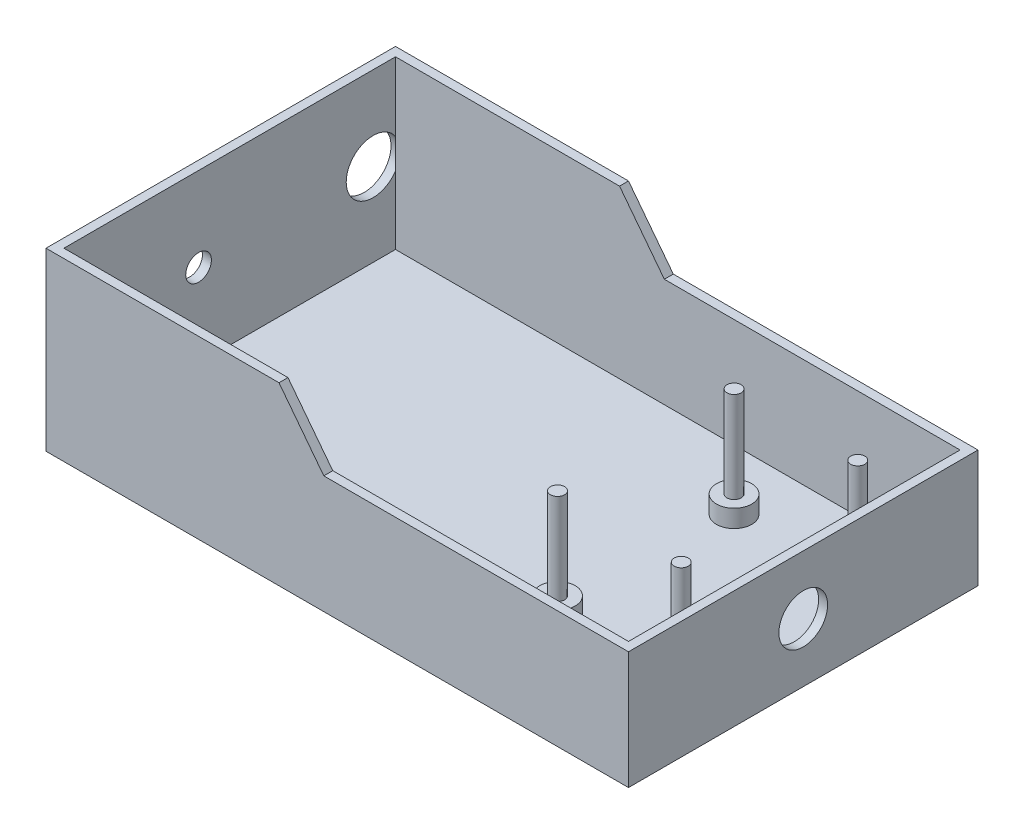
from build123d import *

# Parameters (mm, degrees)
BOSS_EXTRUDE1_DEPTH  = 2.54
SKETCH2_W            = 152.4
SKETCH2_H            = 93.98
BOSS_EXTRUDE2_DEPTH  = 2.54
BOSS_EXTRUDE3_DEPTH  = 2.54
SKETCH4_W            = 152.4
SKETCH4_H            = 2.54
BOSS_EXTRUDE4_DEPTH  = 2.54
BOSS_EXTRUDE13_DEPTH = 2.54
BOSS_EXTRUDE14_DEPTH = 2.54
SKETCH19_W           = 7.62
SKETCH19_H           = 33.3375
BOSS_EXTRUDE15_DEPTH = 2.54
SKETCH20_W           = 7.62
SKETCH20_H           = 33.3375
BOSS_EXTRUDE16_DEPTH = 2.54
SKETCH21_W           = 93.98
SKETCH21_H           = 2.54
BOSS_EXTRUDE17_DEPTH = 7.62
SKETCH22_W           = 2.54
SKETCH22_H           = 33.3375
BOSS_EXTRUDE18_DEPTH = 99.06
SKETCH23_W           = 99.06
SKETCH23_H           = 49.8475
BOSS_EXTRUDE19_DEPTH = 2.54
SKETCH24_R           = 3.639281935
SKETCH24_R_2         = 7.62
SKETCH24_R_3         = 3.285560526
CUT_EXTRUDE2_DEPTH   = 2.54
SKETCH25_R           = 6.906854853
CUT_EXTRUDE3_DEPTH   = 2.54
SKETCH29_R           = 2
BOSS_EXTRUDE20_DEPTH = 30.7975
SKETCH31_R           = 5
BOSS_EXTRUDE21_DEPTH = 5


with BuildPart() as part:
    # Sketch1 → Boss-Extrude1 (new body)
    with BuildSketch(Plane.XY):
        Polygon((0, 0), (152.4, 0), (152.4, 26.9875), (76.2, 26.9875), (63.5, 43.4975), (0, 43.4975), align=None)
    extrude(amount=BOSS_EXTRUDE1_DEPTH)



with BuildPart() as body_2:
    # Sketch2 → Boss-Extrude2 (new body)
    with BuildSketch(Plane(origin=(0, 0, 0), x_dir=(-1, 0, 0), z_dir=(0, -1, 0))):
        with Locations((-76.2, -49.53)):
            Rectangle(SKETCH2_W, SKETCH2_H)
    extrude(amount=BOSS_EXTRUDE2_DEPTH)

    # Sketch3 → Boss-Extrude3 (add)
    with BuildSketch(Plane.XY.offset(96.52)):
        Polygon((0, 0), (0, 43.4975), (63.5, 43.4975), (76.2, 26.9875), (152.4, 26.9875), (152.4, -2.54), (0, -2.54), align=None)
    extrude(amount=BOSS_EXTRUDE3_DEPTH)


with BuildPart() as part_1:
    add(part.part)

    add(body_2.part)  # Boss-Extrude4 merges body 2
    # Sketch4 → Boss-Extrude4 (add)
    with BuildSketch(Plane(origin=(0, 0, 2.54), x_dir=(-1, 0, 0), z_dir=(0, 0, -1))):
        with Locations((-76.2, -1.27)):
            Rectangle(SKETCH4_W, SKETCH4_H)
    extrude(amount=BOSS_EXTRUDE4_DEPTH)

    # Sketch10 → Boss-Extrude13 (add)
    with BuildSketch(Plane(origin=(0, 0, 0), x_dir=(-1, 0, 0), z_dir=(0, 0, -1))):
        Polygon((0, 43.4975), (0, 47.3075), (-63.5, 47.3075), (-76.2, 30.7975), (-152.4, 30.7975), (-152.4, 26.9875), (-76.2, 26.9875), (-63.5, 43.4975), align=None)
    extrude(amount=-BOSS_EXTRUDE13_DEPTH)

    # Sketch18 → Boss-Extrude14 (add)
    with BuildSketch(Plane.XY.offset(99.06)):
        Polygon((0, 43.4975), (0, 47.3075), (63.5, 47.3075), (76.2, 30.7975), (152.4, 30.7975), (152.4, 26.9875), (76.2, 26.9875), (63.5, 43.4975), align=None)
    extrude(amount=-BOSS_EXTRUDE14_DEPTH)

    # Sketch19 → Boss-Extrude15 (add)
    with BuildSketch(Plane.XY.offset(99.06)):
        with Locations((156.21, 14.12875)):
            Rectangle(SKETCH19_W, SKETCH19_H)
    extrude(amount=-BOSS_EXTRUDE15_DEPTH)

    # Sketch20 → Boss-Extrude16 (add)
    with BuildSketch(Plane(origin=(0, 0, 0), x_dir=(-1, 0, 0), z_dir=(0, 0, -1))):
        with Locations((-156.21, 14.12875)):
            Rectangle(SKETCH20_W, SKETCH20_H)
    extrude(amount=-BOSS_EXTRUDE16_DEPTH)

    # Sketch21 → Boss-Extrude17 (add)
    with BuildSketch(Plane(origin=(152.4, 0, 0), x_dir=(0, 0, -1), z_dir=(1, 0, 0))):
        with Locations((-49.53, -1.27)):
            Rectangle(SKETCH21_W, SKETCH21_H)
    extrude(amount=BOSS_EXTRUDE17_DEPTH)

    # Sketch22 → Boss-Extrude18 (add)
    with BuildSketch(Plane.XY.offset(99.06)):
        with Locations((161.29, 14.12875)):
            Rectangle(SKETCH22_W, SKETCH22_H)
    extrude(amount=-BOSS_EXTRUDE18_DEPTH)

    # Sketch23 → Boss-Extrude19 (add)
    with BuildSketch(Plane.ZY):
        with Locations((49.53, 22.38375)):
            Rectangle(SKETCH23_W, SKETCH23_H)
    extrude(amount=BOSS_EXTRUDE19_DEPTH)

    # Sketch24 → Cut-Extrude2 (cut)
    with BuildSketch(Plane.ZY.offset(2.54)):
        with Locations((58.358660758, 23.518484008)):
            Circle(SKETCH24_R)
        with Locations((8.89, 23.518484008)):
            Circle(SKETCH24_R_2)
        with Locations((78.906077051, 23.518484008)):
            Circle(SKETCH24_R_3)
    extrude(amount=-CUT_EXTRUDE2_DEPTH, mode=Mode.SUBTRACT)

    # Sketch25 → Cut-Extrude3 (cut)
    with BuildSketch(Plane(origin=(162.56, 0, 0), x_dir=(0, 0, -1), z_dir=(1, 0, 0))):
        with Locations((-49.53, 14.12875)):
            Circle(SKETCH25_R)
    extrude(amount=-CUT_EXTRUDE3_DEPTH, mode=Mode.SUBTRACT)

    # Sketch29 → Boss-Extrude20 (add)
    with BuildSketch(Plane(origin=(0, 0, 0), x_dir=(1, 0, 0), z_dir=(0, 1, 0))):
        with Locations(Location((112.968, -19.540242478, 0), (0, 0, 90))):
            Circle(SKETCH29_R)
        with Locations(Location((148.02, -19.540242478, 0), (0, 0, 90))):
            Circle(SKETCH29_R)
        with Locations(Location((112.968, -69.578242478, 0), (0, 0, 90))):
            Circle(SKETCH29_R)
        with Locations(Location((148.02, -69.578242478, 0), (0, 0, 90))):
            Circle(SKETCH29_R)
    extrude(amount=BOSS_EXTRUDE20_DEPTH)

    # Sketch31 → Boss-Extrude21 (add)
    with BuildSketch(Plane(origin=(0, 0, 0), x_dir=(1, 0, 0), z_dir=(0, 1, 0))):
        with Locations(Location((112.968, -19.540242478, 0), (0, 0, 90))):
            Circle(SKETCH31_R)
        with Locations(Location((148.02, -19.540242478, 0), (0, 0, 90))):
            Circle(SKETCH31_R)
        with Locations(Location((112.968, -69.578242478, 0), (0, 0, 90))):
            Circle(SKETCH31_R)
        with Locations(Location((148.02, -69.578242478, 0), (0, 0, 90))):
            Circle(SKETCH31_R)
    extrude(amount=BOSS_EXTRUDE21_DEPTH)


solid = part_1.part
